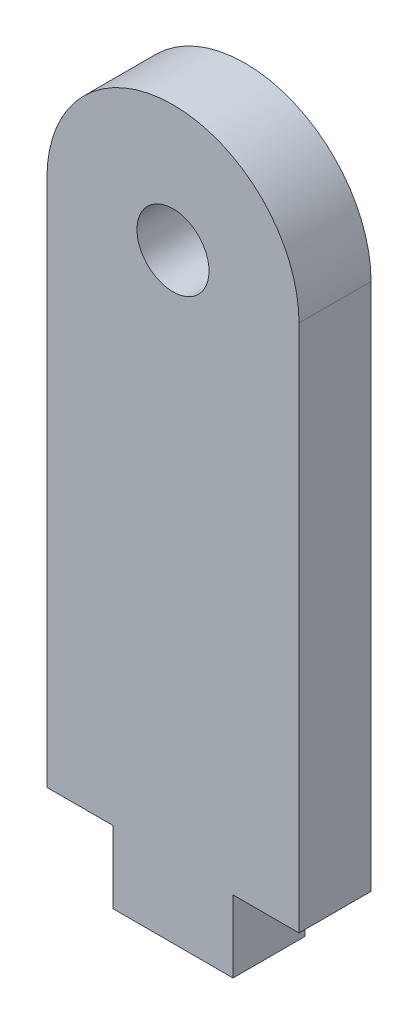
from build123d import *

# Parameters (mm, degrees)
PLATE_THICKNESS_3MM_DEPTH = 3


with BuildPart() as part:
    # Sketch1 → Plate_thickness_3mm (new body)
    with BuildSketch(Plane.XY):
        with BuildLine():
            Line((10.5, 25), (10.5, 3))
            Line((10.5, 3), (7.75, 3))
            Line((7.75, 3), (7.75, 0))
            Line((7.75, 0), (2.75, 0))
            Line((2.75, 0), (2.75, 3))
            Line((2.75, 3), (0, 3))
            Line((0, 3), (0, 25))
            ThreePointArc((0, 25), (1.537689399, 28.712310601), (5.25, 30.25))
            ThreePointArc((5.25, 30.25), (8.962310601, 28.712310601), (10.5, 25))
        make_face()
        with BuildLine():
            ThreePointArc((5.25, 26.5), (3.75, 25), (5.25, 23.5))
            ThreePointArc((5.25, 23.5), (6.75, 25), (5.25, 26.5))
        make_face(mode=Mode.SUBTRACT)
    extrude(amount=PLATE_THICKNESS_3MM_DEPTH)


solid = part.part
